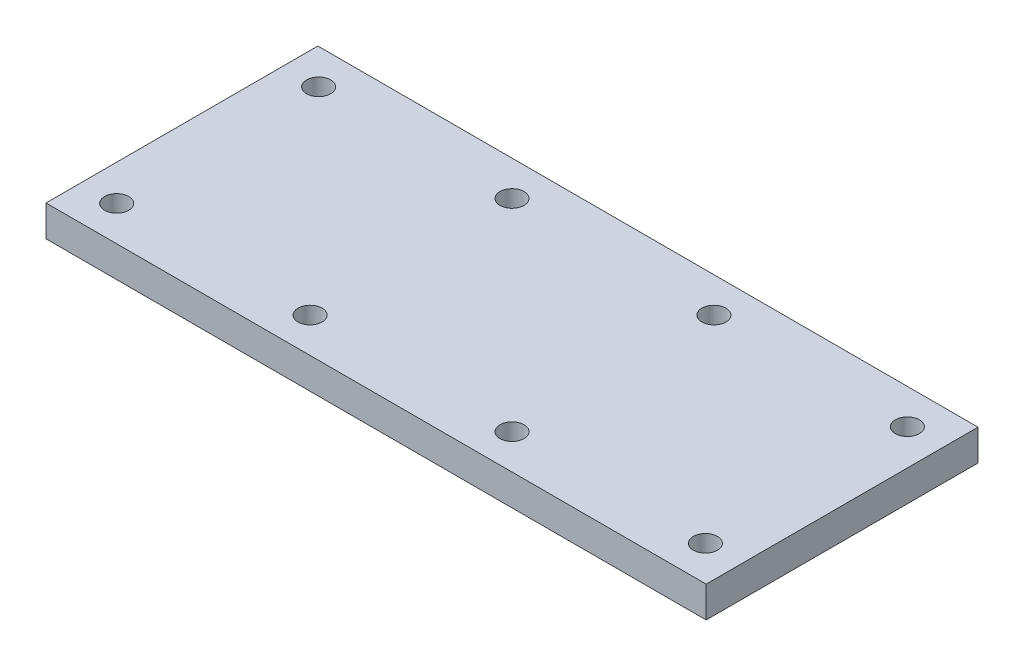
from build123d import *

# Parameters (mm, degrees)
SKETCH_1_W      = 85
SKETCH_1_H      = 35
SKETCH_1_R      = 1.55
EXTRUDE_1_DEPTH = 4


with BuildPart() as part:
    # 草图1 → 凸台-拉伸1 (new body)
    with BuildSketch(Plane(origin=(0, 0, 0), x_dir=(1, 0, 0), z_dir=(0, 1, 0))):
        with Locations((42.5, 17.5)):
            Rectangle(SKETCH_1_W, SKETCH_1_H)
        with Locations(Location((80.4, 30.5, 0), (0, 0, 270))):
            Circle(SKETCH_1_R, mode=Mode.SUBTRACT)
        with Locations(Location((80.4, 4.5, 0), (0, 0, 90))):
            Circle(SKETCH_1_R, mode=Mode.SUBTRACT)
        with Locations(Location((4.6, 30.5, 0), (0, 0, 90))):
            Circle(SKETCH_1_R, mode=Mode.SUBTRACT)
        with Locations(Location((4.6, 4.5, 0), (0, 0, 270))):
            Circle(SKETCH_1_R, mode=Mode.SUBTRACT)
        with Locations(Location((55.5, 30.5, 0), (0, 0, 270))):
            Circle(SKETCH_1_R, mode=Mode.SUBTRACT)
        with Locations(Location((55.5, 4.5, 0), (0, 0, 90))):
            Circle(SKETCH_1_R, mode=Mode.SUBTRACT)
        with Locations(Location((29.5, 4.5, 0), (0, 0, 270))):
            Circle(SKETCH_1_R, mode=Mode.SUBTRACT)
        with Locations(Location((29.5, 30.5, 0), (0, 0, 90))):
            Circle(SKETCH_1_R, mode=Mode.SUBTRACT)
    extrude(amount=EXTRUDE_1_DEPTH)


solid = part.part
